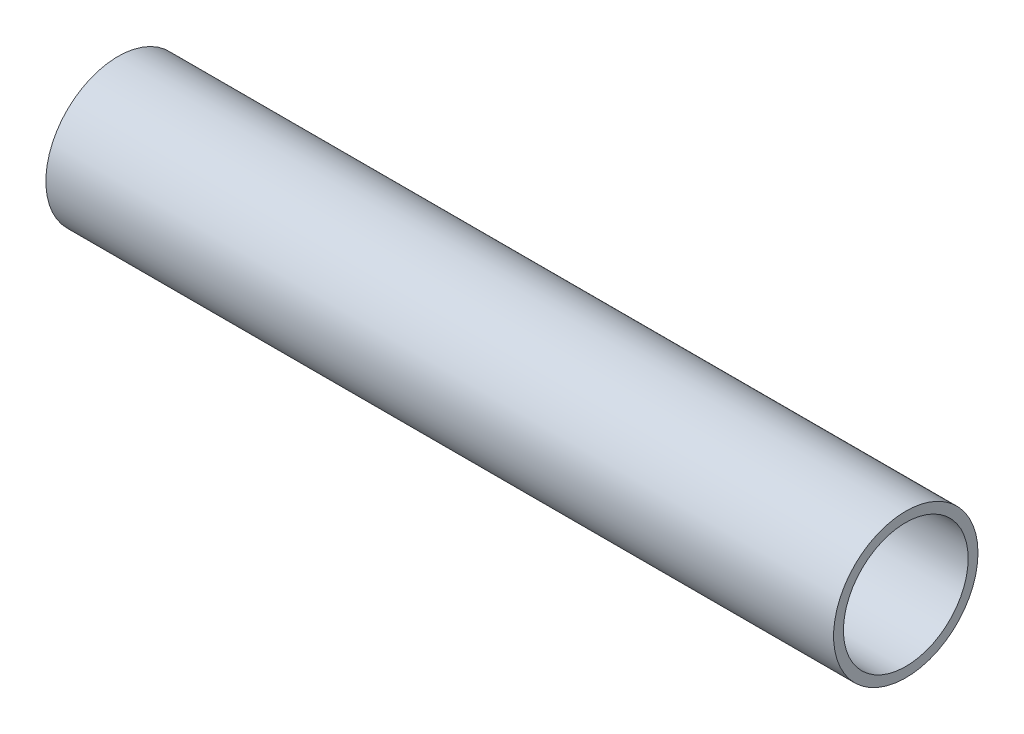
from build123d import *

# Parameters (mm, degrees)
SKETCH1_R           = 11
SKETCH1_R_2         = 9.5
BOSS_EXTRUDE1_DEPTH = 120


with BuildPart() as part:
    # Sketch1 → Boss-Extrude1 (new body)
    with BuildSketch(Plane(origin=(0, 0, 0), x_dir=(0, 0, -1), z_dir=(1, 0, 0))):
        Circle(SKETCH1_R)
        Circle(SKETCH1_R_2, mode=Mode.SUBTRACT)
    extrude(amount=BOSS_EXTRUDE1_DEPTH)


solid = part.part
